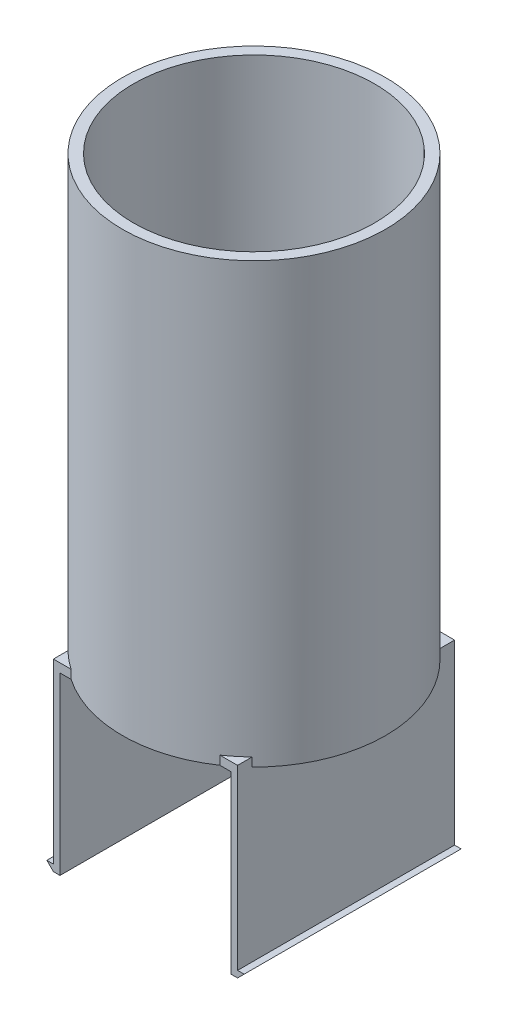
from build123d import *

# Parameters (mm, degrees)
SKETCH1_R           = 30
SKETCH1_R_2         = 27.5
BOSS_EXTRUDE1_DEPTH = 100
SKETCH1_2_R         = 27.5
BOSS_EXTRUDE2_DEPTH = 5
SKETCH2_W           = 1.5
SKETCH2_H           = 49.5
BOSS_EXTRUDE3_DEPTH = 40
SKETCH3_W           = 42
SKETCH3_H           = 49.5
BOSS_EXTRUDE4_DEPTH = 2
BOSS_EXTRUDE5_DEPTH = 49.5


with BuildPart() as part:
    # Sketch1 → Boss-Extrude1 (new body)
    with BuildSketch(Plane(origin=(0, 0, 0), x_dir=(1, 0, 0), z_dir=(0, 1, 0))):
        with Locations(Location((0, 0, 0), (0, 0, 270))):
            Circle(SKETCH1_R)
        with Locations(Location((0, 0, 0), (0, 0, 270))):
            Circle(SKETCH1_R_2, mode=Mode.SUBTRACT)
    extrude(amount=BOSS_EXTRUDE1_DEPTH)

    # Sketch1<2> → Boss-Extrude2 (add)
    with BuildSketch(Plane(origin=(0, 0, 0), x_dir=(1, 0, 0), z_dir=(0, 1, 0))):
        with Locations(Location((0, 0, 0), (0, 0, 270))):
            Circle(SKETCH1_2_R)
    extrude(amount=BOSS_EXTRUDE2_DEPTH)

    # Sketch2 → Boss-Extrude3 (add)
    with BuildSketch(Plane.XZ):
        with Locations((-20.25, 0)):
            Rectangle(SKETCH2_W, SKETCH2_H)
        with Locations((20.25, 0)):
            Rectangle(SKETCH2_W, SKETCH2_H)
    extrude(amount=BOSS_EXTRUDE3_DEPTH)

    # Sketch3 → Boss-Extrude4 (add)
    with BuildSketch(Plane.XZ):
        Rectangle(SKETCH3_W, SKETCH3_H)
    extrude(amount=-BOSS_EXTRUDE4_DEPTH)

    # Sketch4 → Boss-Extrude5 (add)
    with BuildSketch(Plane(origin=(0, 0, -24.75), x_dir=(-1, 0, 0), z_dir=(0, 0, -1))):
        Polygon((21, -40), (22.5, -38.5), (21, -38.5), align=None)
        Polygon((-21, -40), (-22.5, -38.5), (-21, -38.5), align=None)
    extrude(amount=-BOSS_EXTRUDE5_DEPTH)


solid = part.part
